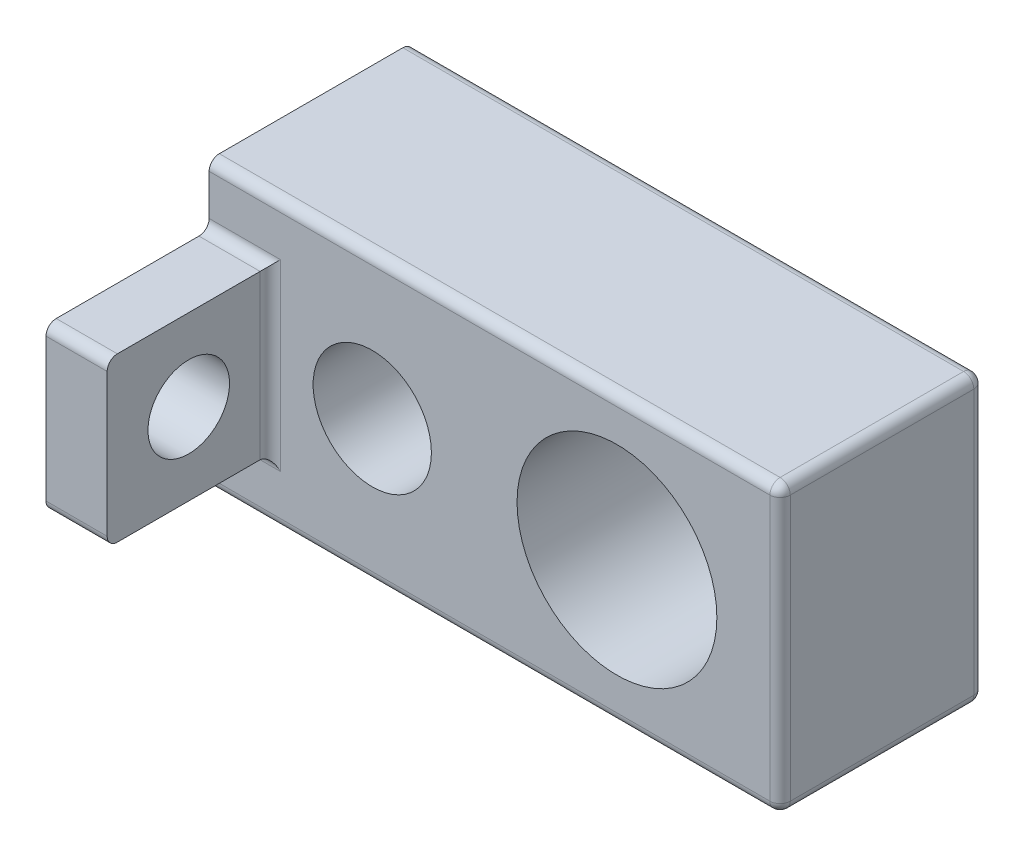
from build123d import *

# Parameters (mm, degrees)
SKETCH1_W           = 14
SKETCH1_H           = 7
BOSS_EXTRUDE1_DEPTH = 5
SKETCH2_R           = 2.45
SKETCH2_R_2         = 1.45
CUT_EXTRUDE1_DEPTH  = 10.287087811
SKETCH5_W           = 4
SKETCH5_H           = 4
BOSS_EXTRUDE3_DEPTH = 1.5
SKETCH9_R           = 1
CUT_EXTRUDE2_DEPTH  = 2
FILLET1_R           = 0.25


with BuildPart() as part:
    # Sketch1 → Boss-Extrude1 (new body)
    with BuildSketch(Plane.XY):
        Rectangle(SKETCH1_W, SKETCH1_H)
    extrude(amount=BOSS_EXTRUDE1_DEPTH)

    # Sketch2 → Cut-Extrude1 (cut, through all)
    with BuildSketch(Plane.XY):
        with Locations((3, 0)):
            Circle(SKETCH2_R)
        with Locations((-3, 0)):
            Circle(SKETCH2_R_2)
    extrude(amount=CUT_EXTRUDE1_DEPTH, mode=Mode.SUBTRACT)

    # Sketch5 → Boss-Extrude3 (add)
    with BuildSketch(Plane.ZY.offset(7)):
        with Locations((7, 0)):
            Rectangle(SKETCH5_W, SKETCH5_H)
    extrude(amount=-BOSS_EXTRUDE3_DEPTH)

    # Sketch9 → Cut-Extrude2 (cut)
    with BuildSketch(Plane(origin=(-5.5, 0, 0), x_dir=(0, 0, -1), z_dir=(1, 0, 0))):
        with Locations((-7, 0)):
            Circle(SKETCH9_R)
    extrude(amount=-CUT_EXTRUDE2_DEPTH, mode=Mode.SUBTRACT)

    # Fillet1
    fillet1_edges = [part.edges().sort_by_distance(p)[0] for p in [
        (7, 0, 5),
        (0, 3.5, 5),
        (-5.5, 0, 5),
        (-6.25, -2, 5),
        (-6.25, 2, 5),
        (-6.25, 2, 9),
        (-6.25, -2, 9),
        (0, 3.5, 0),
        (7, 0, 0),
        (0, -3.5, 0),
        (7, 3.5, 2.5),
        (7, -3.5, 2.5),
        (0, -3.5, 5),
    ]]
    fillet(fillet1_edges, radius=FILLET1_R)


solid = part.part
